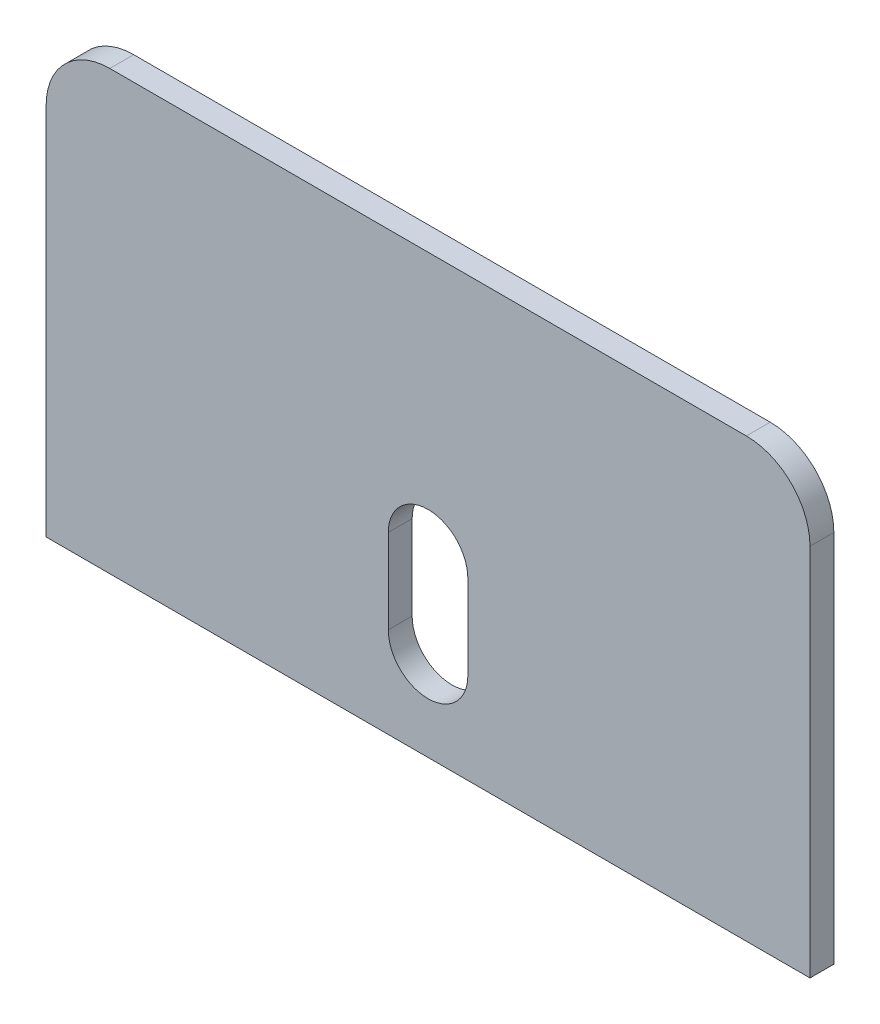
from build123d import *

# Parameters (mm, degrees)
SKETCH1_W           = 96
SKETCH1_H           = 55
BOSS_EXTRUDE1_DEPTH = 1.5
FILLET1_R           = 8


with BuildPart() as part:
    # Sketch1 → Boss-Extrude1 (new, symmetric)
    with BuildSketch(Plane.XY):
        Rectangle(SKETCH1_W, SKETCH1_H)
        with BuildLine():
            Line((-5, -16.1), (-5, -5.5))
            ThreePointArc((-5, -5.5), (0, -0.5), (5, -5.5))
            Line((5, -5.5), (5, -16.1))
            ThreePointArc((5, -16.1), (0, -21.1), (-5, -16.1))
        make_face(mode=Mode.SUBTRACT)
    extrude(amount=BOSS_EXTRUDE1_DEPTH, both=True)

    # Fillet1
    fillet1_edges = [part.edges().sort_by_distance(p)[0] for p in [
        (-48, 27.5, 0),
        (48, 27.5, 0),
    ]]
    fillet(fillet1_edges, radius=FILLET1_R)


solid = part.part
